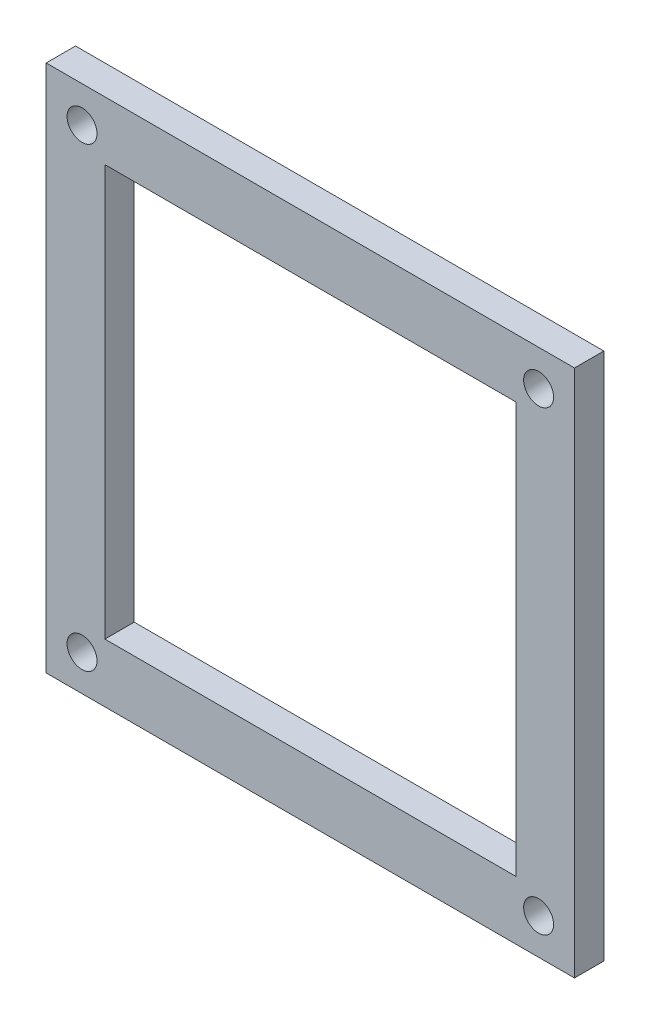
from build123d import *

# Parameters (mm, degrees)
SKETCH1_W           = 90
SKETCH1_H           = 90
SKETCH1_R           = 2.55
SKETCH1_W_2         = 70
SKETCH1_H_2         = 70
BOSS_EXTRUDE1_DEPTH = 5


with BuildPart() as part:
    # Sketch1 → Boss-Extrude1 (new body)
    with BuildSketch(Plane.XY):
        Rectangle(SKETCH1_W, SKETCH1_H)
        with Locations((-38.890872965, 38.890872965)):
            Circle(SKETCH1_R, mode=Mode.SUBTRACT)
        with Locations(Location((38.890872965, 38.890872965, 0), (0, 0, 180))):
            Circle(SKETCH1_R, mode=Mode.SUBTRACT)
        with Locations((38.890872965, -38.890872965)):
            Circle(SKETCH1_R, mode=Mode.SUBTRACT)
        with Locations(Location((-38.890872965, -38.890872965, 0), (0, 0, 180))):
            Circle(SKETCH1_R, mode=Mode.SUBTRACT)
        Rectangle(SKETCH1_W_2, SKETCH1_H_2, mode=Mode.SUBTRACT)
    extrude(amount=BOSS_EXTRUDE1_DEPTH)


solid = part.part
